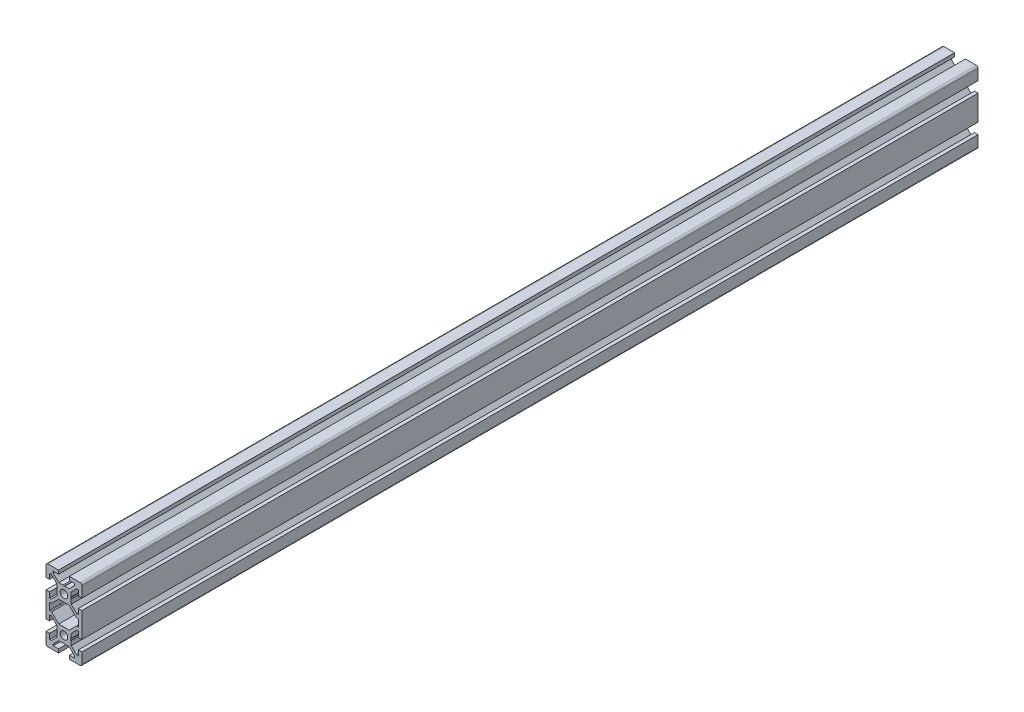
from build123d import *

# Parameters (mm, degrees)
SKETCH1_R           = 2.1
BOSS_EXTRUDE1_DEPTH = 249.555


with BuildPart() as part:
    # Sketch1 → Boss-Extrude1 (new, symmetric)
    with BuildSketch(Plane(origin=(0, 0, -50), x_dir=(-1, 0, 0), z_dir=(0, 0, -1))):
        with BuildLine():
            Line((10, -7), (10, 7))
            Line((10, 7), (8, 7))
            Line((8, 7), (8, 4))
            Line((8, 4), (7.060660172, 4))
            Line((7.060660172, 4), (4, 7.060660172))
            Line((4, 7.060660172), (4, 9.480384758))
            Line((4, 9.480384758), (3.7, 10))
            Line((3.7, 10), (4, 10.519615242))
            Line((4, 10.519615242), (4, 12.939339828))
            Line((4, 12.939339828), (7.060660172, 16))
            Line((7.060660172, 16), (8, 16))
            Line((8, 16), (8, 13))
            Line((8, 13), (10, 13))
            Line((10, 13), (10, 19))
            ThreePointArc((10, 19), (9.707106781, 19.707106781), (9, 20))
            Line((9, 20), (3, 20))
            Line((3, 20), (3, 18))
            Line((3, 18), (6, 18))
            Line((6, 18), (6, 17.060660172))
            Line((6, 17.060660172), (2.939339828, 14))
            Line((2.939339828, 14), (0.519615242, 14))
            Line((0.519615242, 14), (0, 13.7))
            Line((0, 13.7), (-0.519615242, 14))
            Line((-0.519615242, 14), (-2.939339828, 14))
            Line((-2.939339828, 14), (-6, 17.060660172))
            Line((-6, 17.060660172), (-6, 18))
            Line((-6, 18), (-3, 18))
            Line((-3, 18), (-3, 20))
            Line((-3, 20), (-9, 20))
            ThreePointArc((-9, 20), (-9.707106781, 19.707106781), (-10, 19))
            Line((-10, 19), (-10, 13))
            Line((-10, 13), (-8, 13))
            Line((-8, 13), (-8, 16))
            Line((-8, 16), (-7.060660172, 16))
            Line((-7.060660172, 16), (-4, 12.939339828))
            Line((-4, 12.939339828), (-4, 10.519615242))
            Line((-4, 10.519615242), (-3.7, 10))
            Line((-3.7, 10), (-4, 9.480384758))
            Line((-4, 9.480384758), (-4, 7.060660172))
            Line((-4, 7.060660172), (-7.060660172, 4))
            Line((-7.060660172, 4), (-8, 4))
            Line((-8, 4), (-8, 7))
            Line((-8, 7), (-10, 7))
            Line((-10, 7), (-10, -7))
            Line((-10, -7), (-8, -7))
            Line((-8, -7), (-8, -4))
            Line((-8, -4), (-7.060660172, -4))
            Line((-7.060660172, -4), (-4, -7.060660172))
            Line((-4, -7.060660172), (-4, -9.480384758))
            Line((-4, -9.480384758), (-3.7, -10))
            Line((-3.7, -10), (-4, -10.519615242))
            Line((-4, -10.519615242), (-4, -12.939339828))
            Line((-4, -12.939339828), (-7.060660172, -16))
            Line((-7.060660172, -16), (-8, -16))
            Line((-8, -16), (-8, -13))
            Line((-8, -13), (-10, -13))
            Line((-10, -13), (-10, -19))
            ThreePointArc((-10, -19), (-9.707106781, -19.707106781), (-9, -20))
            Line((-9, -20), (-3, -20))
            Line((-3, -20), (-3, -18))
            Line((-3, -18), (-6, -18))
            Line((-6, -18), (-6, -17.060660172))
            Line((-6, -17.060660172), (-2.939339828, -14))
            Line((-2.939339828, -14), (-0.519615242, -14))
            Line((-0.519615242, -14), (0, -13.7))
            Line((0, -13.7), (0.519615242, -14))
            Line((0.519615242, -14), (2.939339828, -14))
            Line((2.939339828, -14), (6, -17.060660172))
            Line((6, -17.060660172), (6, -18))
            Line((6, -18), (3, -18))
            Line((3, -18), (3, -20))
            Line((3, -20), (9, -20))
            ThreePointArc((9, -20), (9.707106781, -19.707106781), (10, -19))
            Line((10, -19), (10, -13))
            Line((10, -13), (8, -13))
            Line((8, -13), (8, -16))
            Line((8, -16), (7.060660172, -16))
            Line((7.060660172, -16), (4, -12.939339828))
            Line((4, -12.939339828), (4, -10.519615242))
            Line((4, -10.519615242), (3.7, -10))
            Line((3.7, -10), (4, -9.480384758))
            Line((4, -9.480384758), (4, -7.060660172))
            Line((4, -7.060660172), (7.060660172, -4))
            Line((7.060660172, -4), (8, -4))
            Line((8, -4), (8, -7))
            Line((8, -7), (10, -7))
        make_face()
        with Locations(Location((0, -10, 0), (0, 0, 180))):
            Circle(SKETCH1_R, mode=Mode.SUBTRACT)
        with Locations(Location((0, 10, 0), (0, 0, 180))):
            Circle(SKETCH1_R, mode=Mode.SUBTRACT)
        with BuildLine():
            Line((8, 1.7), (8, -1.7))
            ThreePointArc((8, -1.7), (7.912132034, -1.912132034), (7.7, -2))
            Line((7.7, -2), (7.063603897, -2))
            ThreePointArc((7.063603897, -2), (6.948798867, -2.02283614), (6.851471863, -2.087867966))
            Line((6.851471863, -2.087867966), (2.939339828, -6))
            Line((2.939339828, -6), (-2.939339828, -6))
            Line((-2.939339828, -6), (-6.851471863, -2.087867966))
            ThreePointArc((-6.851471863, -2.087867966), (-6.948798867, -2.02283614), (-7.063603897, -2))
            Line((-7.063603897, -2), (-7.7, -2))
            ThreePointArc((-7.7, -2), (-7.912132034, -1.912132034), (-8, -1.7))
            Line((-8, -1.7), (-8, 1.7))
            ThreePointArc((-8, 1.7), (-7.912132034, 1.912132034), (-7.7, 2))
            Line((-7.7, 2), (-7.063603897, 2))
            ThreePointArc((-7.063603897, 2), (-6.948798867, 2.02283614), (-6.851471863, 2.087867966))
            Line((-6.851471863, 2.087867966), (-2.939339828, 6))
            Line((-2.939339828, 6), (2.939339828, 6))
            Line((2.939339828, 6), (6.851471863, 2.087867966))
            ThreePointArc((6.851471863, 2.087867966), (6.948798867, 2.02283614), (7.063603897, 2))
            Line((7.063603897, 2), (7.7, 2))
            ThreePointArc((7.7, 2), (7.912132034, 1.912132034), (8, 1.7))
        make_face(mode=Mode.SUBTRACT)
    extrude(amount=BOSS_EXTRUDE1_DEPTH, both=True)


solid = part.part
